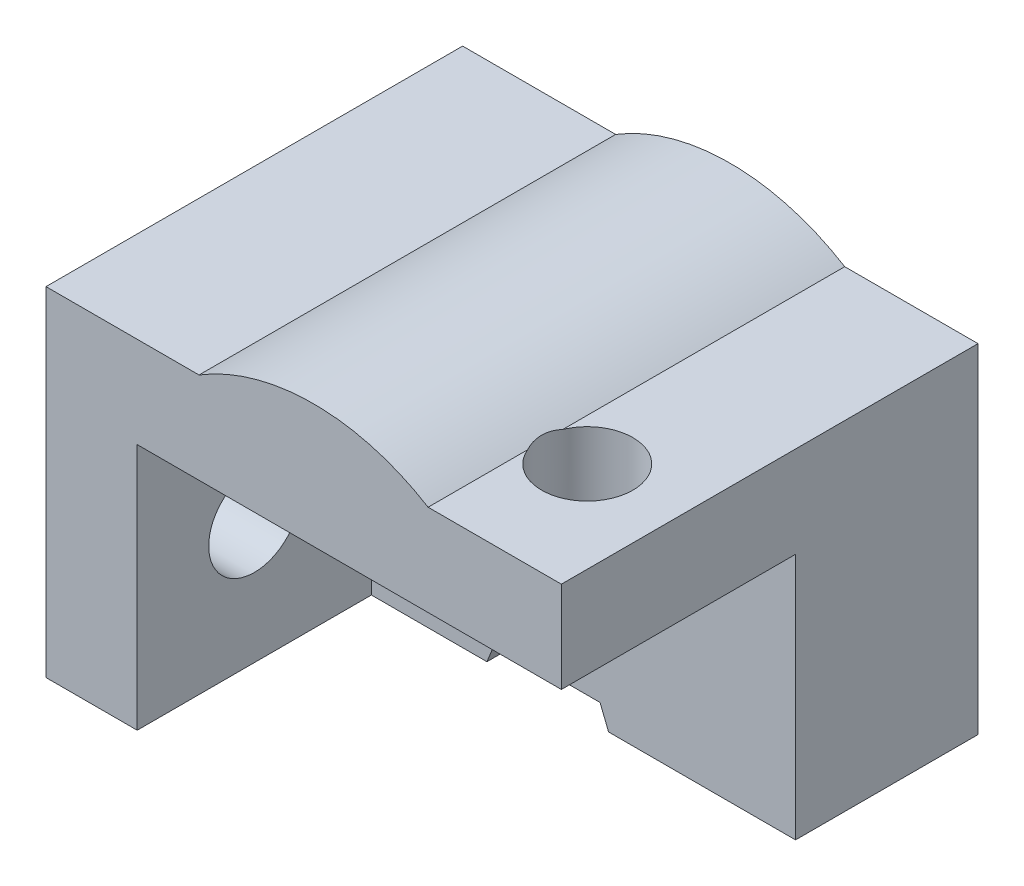
from build123d import *

# Parameters (mm, degrees)
EXTRUDE_1_DEPTH     = 6
EXTRUDE_START       = 7.702227827
EXTRUDE_2_DEPTH     = 7.702227827
SKETCH_4_R          = 1.5
CUT_EXTRUDE_1_DEPTH = 6
SKETCH_5_R          = 1.5
CUT_EXTRUDE_2_DEPTH = 6


with BuildPart() as part:
    # Эскиз1 → Бобышка-Вытянуть1 (new body)
    with BuildSketch(Plane.XY):
        with BuildLine():
            Line((-416.117492961, 132.337705363), (-409.317492962, 132.337705363))
            Line((-409.317492962, 132.337705363), (-409.037492962, 133.037705363))
            Line((-409.037492962, 133.037705363), (-405.597492962, 133.037705363))
            Line((-405.597492962, 133.037705363), (-405.317492962, 132.337705363))
            Line((-405.317492962, 132.337705363), (-399.167492961, 132.337705363))
            Line((-399.167492961, 132.337705363), (-399.167492961, 143.47382058))
            Line((-399.167492961, 143.47382058), (-403.550784843, 143.47382058))
            ThreePointArc((-403.550784843, 143.47382058), (-407.317492962, 144.537705363), (-411.08420108, 143.47382058))
            Line((-411.08420108, 143.47382058), (-416.117492961, 143.47382058))
            Line((-416.117492961, 143.47382058), (-416.117492961, 132.337705363))
        make_face()
    extrude(amount=-EXTRUDE_1_DEPTH)

    # Эскиз2 → Вырез-Повернуть1 (revolve, cut)
    with BuildSketch(Plane(origin=(-407.317492962, 0, 0), x_dir=(0, 0, -1), z_dir=(1, 0, 0)), mode=Mode.PRIVATE) as cut_revolve_1_sk:
        Polygon((6.135092005, 142.437705363), (1.9, 142.437705363), (1.9, 141.109187411), (1.4, 141.109187411), (1.4, 137.337705363), (6.135092005, 137.337705363), align=None)
    revolve(cut_revolve_1_sk.sketch.rotate(Axis((-407.317492962, 137.337705363, -4.1), (0, 0, 1)), 90), axis=Axis((-407.317492962, 137.337705363, -4.1), (0, 0, 1)), mode=Mode.SUBTRACT)

    # Эскиз3 → Бобышка-Вытянуть2 (add)
    with BuildSketch(Plane.XY.offset(EXTRUDE_START)):
        with BuildLine():
            Line((-413.117492961, 140.47382058), (-413.117492961, 132.337705363))
            Line((-413.117492961, 132.337705363), (-416.117492961, 132.337705363))
            Line((-416.117492961, 132.337705363), (-416.117492961, 143.47382058))
            Line((-416.117492961, 143.47382058), (-411.08420108, 143.47382058))
            ThreePointArc((-411.08420108, 143.47382058), (-407.317492962, 144.537705363), (-403.550784843, 143.47382058))
            Line((-403.550784843, 143.47382058), (-399.167492961, 143.47382058))
            Line((-399.167492961, 143.47382058), (-399.167492961, 140.47382058))
            Line((-399.167492961, 140.47382058), (-413.117492961, 140.47382058))
        make_face()
    extrude(amount=-EXTRUDE_2_DEPTH)

    # Эскиз4 → Вырез-Вытянуть1 (cut)
    with BuildSketch(Plane(origin=(-413.117492961, 0, 0), x_dir=(0, 0, -1), z_dir=(1, 0, 0))):
        with Locations((-3.851113914, 136.405762972)):
            Circle(SKETCH_4_R)
    extrude(amount=-CUT_EXTRUDE_1_DEPTH, mode=Mode.SUBTRACT)

    # Эскиз5 → Вырез-Вытянуть2 (cut)
    with BuildSketch(Plane.XZ.offset(-140.47382058)):
        with Locations(Location((-402.167492961, 3.851113914, 0), (0, 0, 270))):
            Circle(SKETCH_5_R)
    extrude(amount=-CUT_EXTRUDE_2_DEPTH, mode=Mode.SUBTRACT)


solid = part.part
